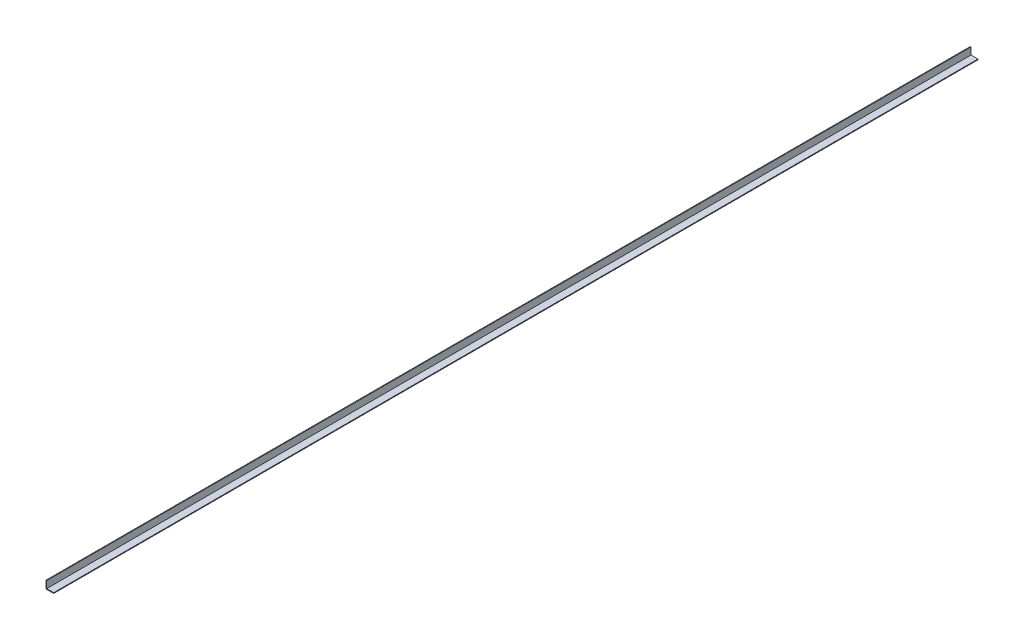
from build123d import *

# Parameters (mm, degrees)
SALIENTE_EXTRUIR1_DEPTH = 6100


with BuildPart() as part:
    # Croquis1 → Saliente-Extruir1 (new body)
    with BuildSketch(Plane.XY):
        Polygon((0, 50.8), (0, 0), (50.8, 0), (50.8, 4.76), (4.76, 4.76), (4.76, 50.8), align=None)
    extrude(amount=-SALIENTE_EXTRUIR1_DEPTH)


solid = part.part
